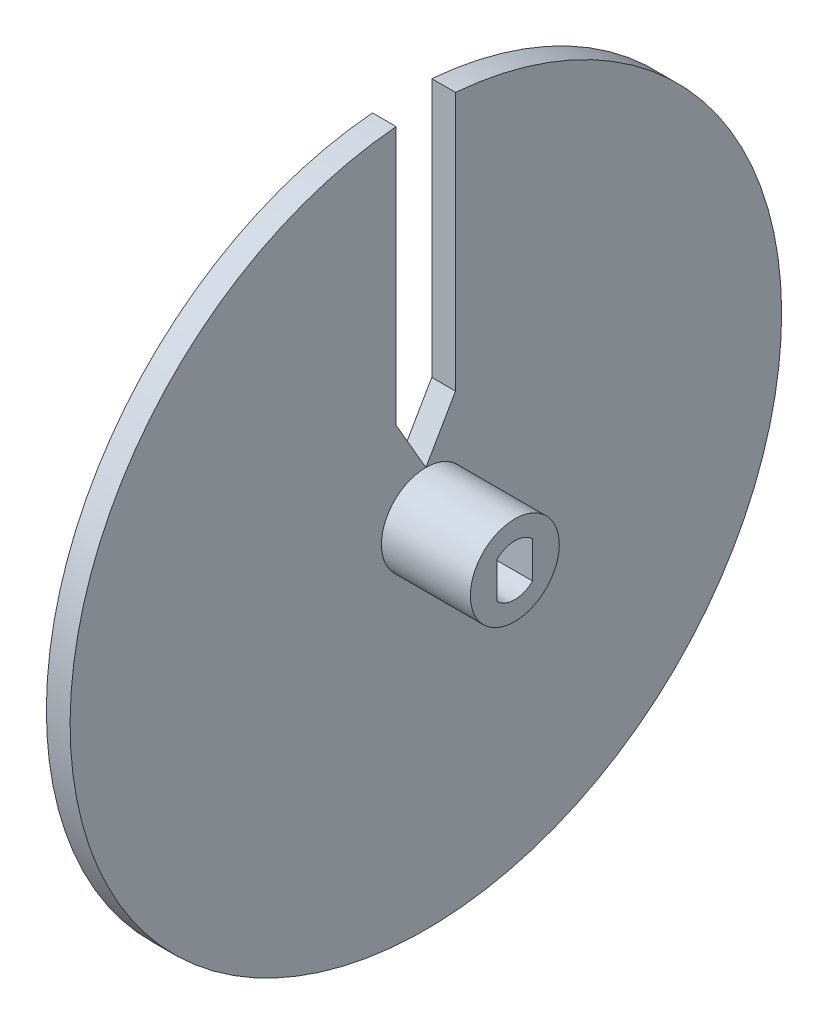
from build123d import *

# Parameters (mm, degrees)
SKETCH1_R               = 4.7625
BOSS_EXTRUDE1_DEPTH     = 9.525
SKETCH2_R               = 38.1
BOSS_EXTRUDE2_DEPTH     = 2.54
CUT_EXTRUDE1_DEPTH      = 55.716959208
CUT_EXTRUDE1_DEPTH_BACK = 55.716959208


with BuildPart() as part:
    # Sketch1 → Boss-Extrude1 (new body)
    with BuildSketch(Plane(origin=(0, 0, 0), x_dir=(0, 0, -1), z_dir=(1, 0, 0))):
        with Locations(Location((0, 0, 0), (0, 0, 180))):
            Circle(SKETCH1_R)
        with BuildLine():
            Line((-1.905, -1.956171069), (-1.905, 1.956171069))
            ThreePointArc((-1.905, 1.956171069), (0, 2.7305), (1.905, 1.956171069))
            Line((1.905, 1.956171069), (1.905, -1.956171069))
            ThreePointArc((1.905, -1.956171069), (0, -2.7305), (-1.905, -1.956171069))
        make_face(mode=Mode.SUBTRACT)
    extrude(amount=BOSS_EXTRUDE1_DEPTH)

    # Sketch2 → Boss-Extrude2 (add)
    with BuildSketch(Plane.ZY):
        Circle(SKETCH2_R)
    extrude(amount=BOSS_EXTRUDE2_DEPTH)

    # Sketch3 → Cut-Extrude1 (cut, two sides: drawn at the far end of the back side and taken through both)
    with BuildSketch(Plane(origin=(0, 0, 0), x_dir=(0, 0, -1), z_dir=(1, 0, 0)).offset(-CUT_EXTRUDE1_DEPTH_BACK)):
        Polygon((-3.175, 10.261761314), (0, 4.7625), (3.175, 10.261761314), (3.175, 38.1), (-3.175, 38.1), align=None)
    extrude(amount=CUT_EXTRUDE1_DEPTH + CUT_EXTRUDE1_DEPTH_BACK, mode=Mode.SUBTRACT)


solid = part.part
